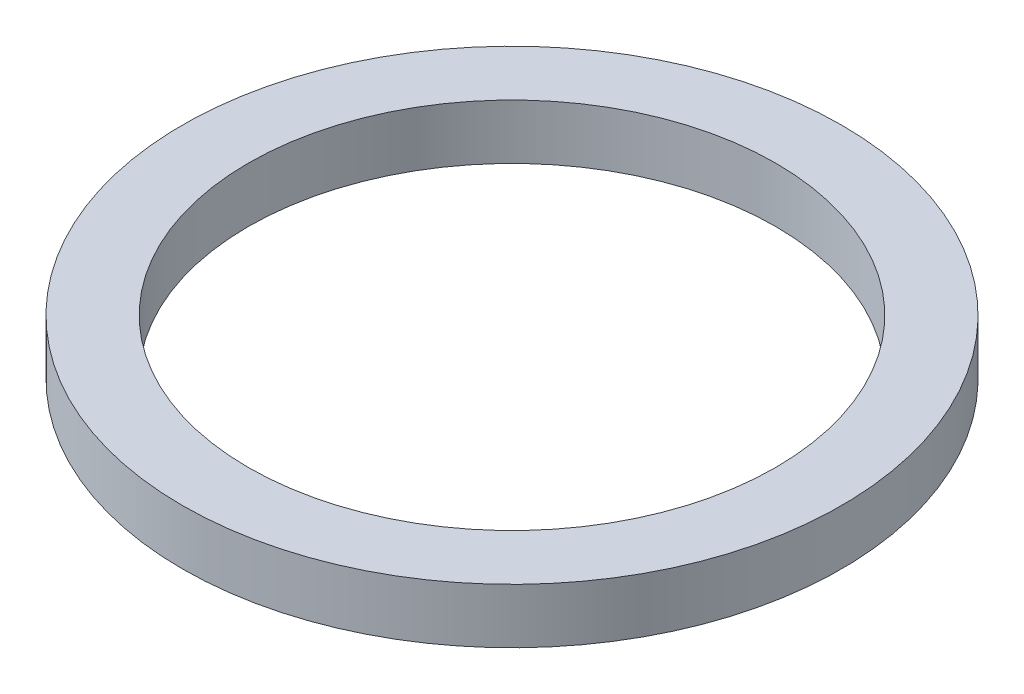
from build123d import *

# Parameters (mm, degrees)
SKETCH1_R           = 30
SKETCH1_R_2         = 24
BOSS_EXTRUDE1_DEPTH = 5


with BuildPart() as part:
    # Sketch1 → Boss-Extrude1 (new body)
    with BuildSketch(Plane(origin=(0, 0, 0), x_dir=(1, 0, 0), z_dir=(0, 1, 0))):
        with Locations(Location((0, 0, 0), (0, 0, 270))):
            Circle(SKETCH1_R)
        with Locations(Location((0, 0, 0), (0, 0, 270))):
            Circle(SKETCH1_R_2, mode=Mode.SUBTRACT)
    extrude(amount=BOSS_EXTRUDE1_DEPTH)


solid = part.part
